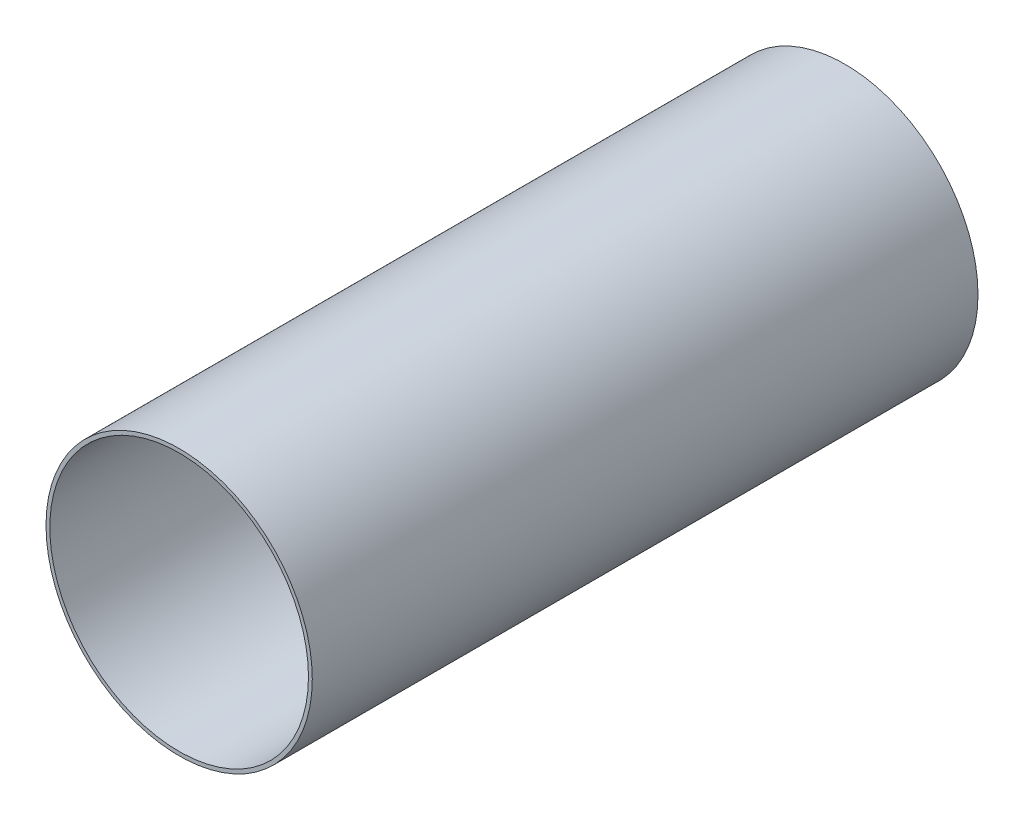
from build123d import *

# Parameters (mm, degrees)
SKETCH1_R           = 17.5
SKETCH1_R_2         = 17
BOSS_EXTRUDE1_DEPTH = 87.5


with BuildPart() as part:
    # Sketch1 → Boss-Extrude1 (new body)
    with BuildSketch(Plane.XY):
        Circle(SKETCH1_R)
        Circle(SKETCH1_R_2, mode=Mode.SUBTRACT)
    extrude(amount=BOSS_EXTRUDE1_DEPTH)


solid = part.part
